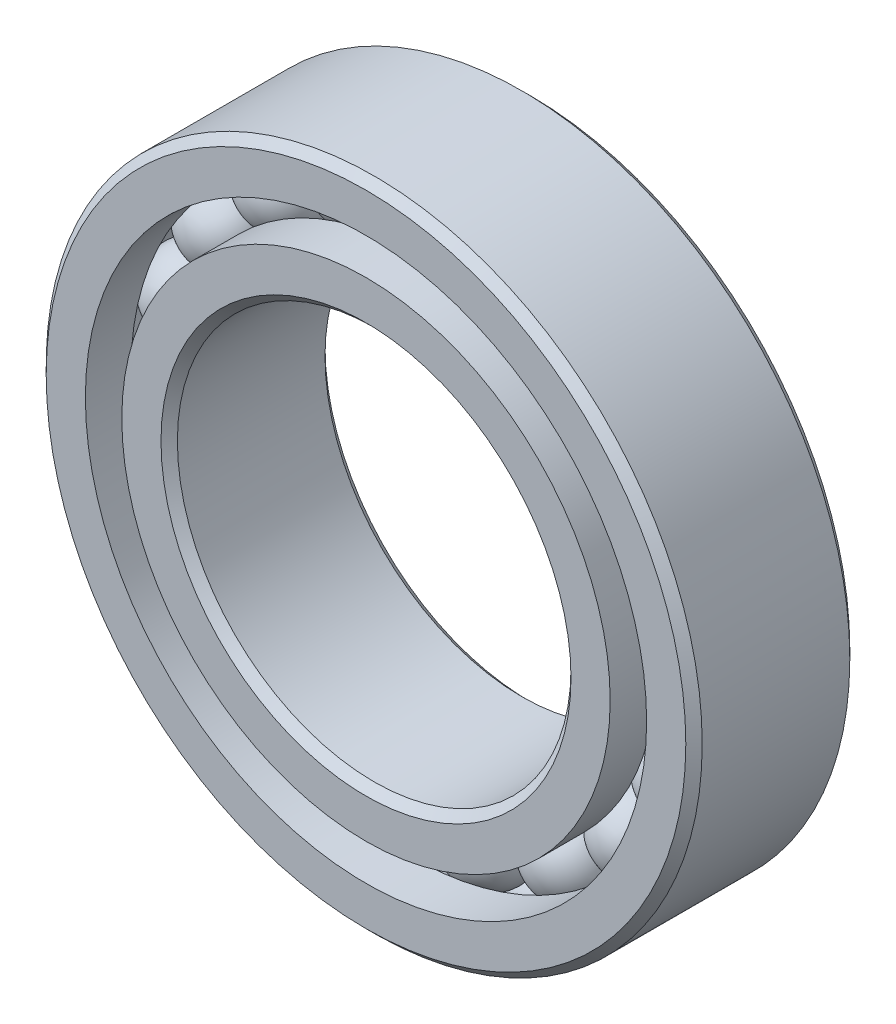
from build123d import *

# Parameters (mm, degrees)
CIRPATTERN1_COUNT = 19


with BuildPart() as part:
    # Sketch1 → Revolve1 (revolve)
    with BuildSketch(Plane(origin=(0, 0, 0), x_dir=(0, 0, -1), z_dir=(1, 0, 0))):
        with BuildLine():
            Line((1.125, 5), (-1.125, 5))
            Line((-1.125, 5), (-1.25, 4.875))
            Line((-1.25, 4.875), (-1.25, 4.277777778))
            Line((-1.25, 4.277777778), (-0.555555556, 4.277777778))
            ThreePointArc((-0.555555556, 4.277777778), (0, 4.621129994), (0.555555556, 4.277777778))
            Line((0.555555556, 4.277777778), (1.25, 4.277777778))
            Line((1.25, 4.277777778), (1.25, 4.875))
            Line((1.25, 4.875), (1.125, 5))
        make_face()
    revolve(axis=Axis((0, 0, 1.25), (0, 0, -1)))


with BuildPart() as body_2:
    # Sketch2 → Revolve2 (revolve)
    with BuildSketch(Plane(origin=(0, 0, 0), x_dir=(0, 0, -1), z_dir=(1, 0, 0))):
        with BuildLine():
            Line((-1.25, 3.722222222), (-0.555555556, 3.722222222))
            ThreePointArc((-0.555555556, 3.722222222), (0, 3.378870006), (0.555555556, 3.722222222))
            Line((0.555555556, 3.722222222), (1.25, 3.722222222))
            Line((1.25, 3.722222222), (1.25, 3.125))
            Line((1.25, 3.125), (1.125, 3))
            Line((1.125, 3), (-1.125, 3))
            Line((-1.125, 3), (-1.25, 3.125))
            Line((-1.25, 3.125), (-1.25, 3.722222222))
        make_face()
    revolve(axis=Axis((0, 0, 1.25), (0, 0, -1)))


with BuildPart() as body_3:
    # Sketch3 → Revolve3 (revolve)
    with BuildSketch(Plane(origin=(0, 0, 0), x_dir=(0, 0, -1), z_dir=(1, 0, 0))):
        with BuildLine():
            Line((-0.621129994, 4), (0.621129994, 4))
            ThreePointArc((0.621129994, 4), (0, 4.621129994), (-0.621129994, 4))
        make_face()
    revolve(axis=Axis((0, 4, 0.621129994), (0, 0, -1)))


with BuildPart() as cirpattern1_1:
    # CirPattern1: pattern copy
    add(body_3.part.rotate(Axis((0, 0, -1.25), (0, 0, 1)), 1 * 360 / CIRPATTERN1_COUNT))


with BuildPart() as cirpattern1_2:
    # CirPattern1: pattern copy
    add(body_3.part.rotate(Axis((0, 0, -1.25), (0, 0, 1)), 2 * 360 / CIRPATTERN1_COUNT))


with BuildPart() as cirpattern1_3:
    # CirPattern1: pattern copy
    add(body_3.part.rotate(Axis((0, 0, -1.25), (0, 0, 1)), 3 * 360 / CIRPATTERN1_COUNT))


with BuildPart() as cirpattern1_4:
    # CirPattern1: pattern copy
    add(body_3.part.rotate(Axis((0, 0, -1.25), (0, 0, 1)), 4 * 360 / CIRPATTERN1_COUNT))


with BuildPart() as cirpattern1_5:
    # CirPattern1: pattern copy
    add(body_3.part.rotate(Axis((0, 0, -1.25), (0, 0, 1)), 5 * 360 / CIRPATTERN1_COUNT))


with BuildPart() as cirpattern1_6:
    # CirPattern1: pattern copy
    add(body_3.part.rotate(Axis((0, 0, -1.25), (0, 0, 1)), 6 * 360 / CIRPATTERN1_COUNT))


with BuildPart() as cirpattern1_7:
    # CirPattern1: pattern copy
    add(body_3.part.rotate(Axis((0, 0, -1.25), (0, 0, 1)), 7 * 360 / CIRPATTERN1_COUNT))


with BuildPart() as cirpattern1_8:
    # CirPattern1: pattern copy
    add(body_3.part.rotate(Axis((0, 0, -1.25), (0, 0, 1)), 8 * 360 / CIRPATTERN1_COUNT))


with BuildPart() as cirpattern1_9:
    # CirPattern1: pattern copy
    add(body_3.part.rotate(Axis((0, 0, -1.25), (0, 0, 1)), 9 * 360 / CIRPATTERN1_COUNT))


with BuildPart() as cirpattern1_10:
    # CirPattern1: pattern copy
    add(body_3.part.rotate(Axis((0, 0, -1.25), (0, 0, 1)), 10 * 360 / CIRPATTERN1_COUNT))


with BuildPart() as cirpattern1_11:
    # CirPattern1: pattern copy
    add(body_3.part.rotate(Axis((0, 0, -1.25), (0, 0, 1)), 11 * 360 / CIRPATTERN1_COUNT))


with BuildPart() as cirpattern1_12:
    # CirPattern1: pattern copy
    add(body_3.part.rotate(Axis((0, 0, -1.25), (0, 0, 1)), 12 * 360 / CIRPATTERN1_COUNT))


with BuildPart() as cirpattern1_13:
    # CirPattern1: pattern copy
    add(body_3.part.rotate(Axis((0, 0, -1.25), (0, 0, 1)), 13 * 360 / CIRPATTERN1_COUNT))


with BuildPart() as cirpattern1_14:
    # CirPattern1: pattern copy
    add(body_3.part.rotate(Axis((0, 0, -1.25), (0, 0, 1)), 14 * 360 / CIRPATTERN1_COUNT))


with BuildPart() as cirpattern1_15:
    # CirPattern1: pattern copy
    add(body_3.part.rotate(Axis((0, 0, -1.25), (0, 0, 1)), 15 * 360 / CIRPATTERN1_COUNT))


with BuildPart() as cirpattern1_16:
    # CirPattern1: pattern copy
    add(body_3.part.rotate(Axis((0, 0, -1.25), (0, 0, 1)), 16 * 360 / CIRPATTERN1_COUNT))


with BuildPart() as cirpattern1_17:
    # CirPattern1: pattern copy
    add(body_3.part.rotate(Axis((0, 0, -1.25), (0, 0, 1)), 17 * 360 / CIRPATTERN1_COUNT))


with BuildPart() as cirpattern1_18:
    # CirPattern1: pattern copy
    add(body_3.part.rotate(Axis((0, 0, -1.25), (0, 0, 1)), 18 * 360 / CIRPATTERN1_COUNT))


solid = Compound([part.part, body_2.part, body_3.part, cirpattern1_1.part, cirpattern1_2.part, cirpattern1_3.part, cirpattern1_4.part, cirpattern1_5.part, cirpattern1_6.part, cirpattern1_7.part, cirpattern1_8.part, cirpattern1_9.part, cirpattern1_10.part, cirpattern1_11.part, cirpattern1_12.part, cirpattern1_13.part, cirpattern1_14.part, cirpattern1_15.part, cirpattern1_16.part, cirpattern1_17.part, cirpattern1_18.part])
